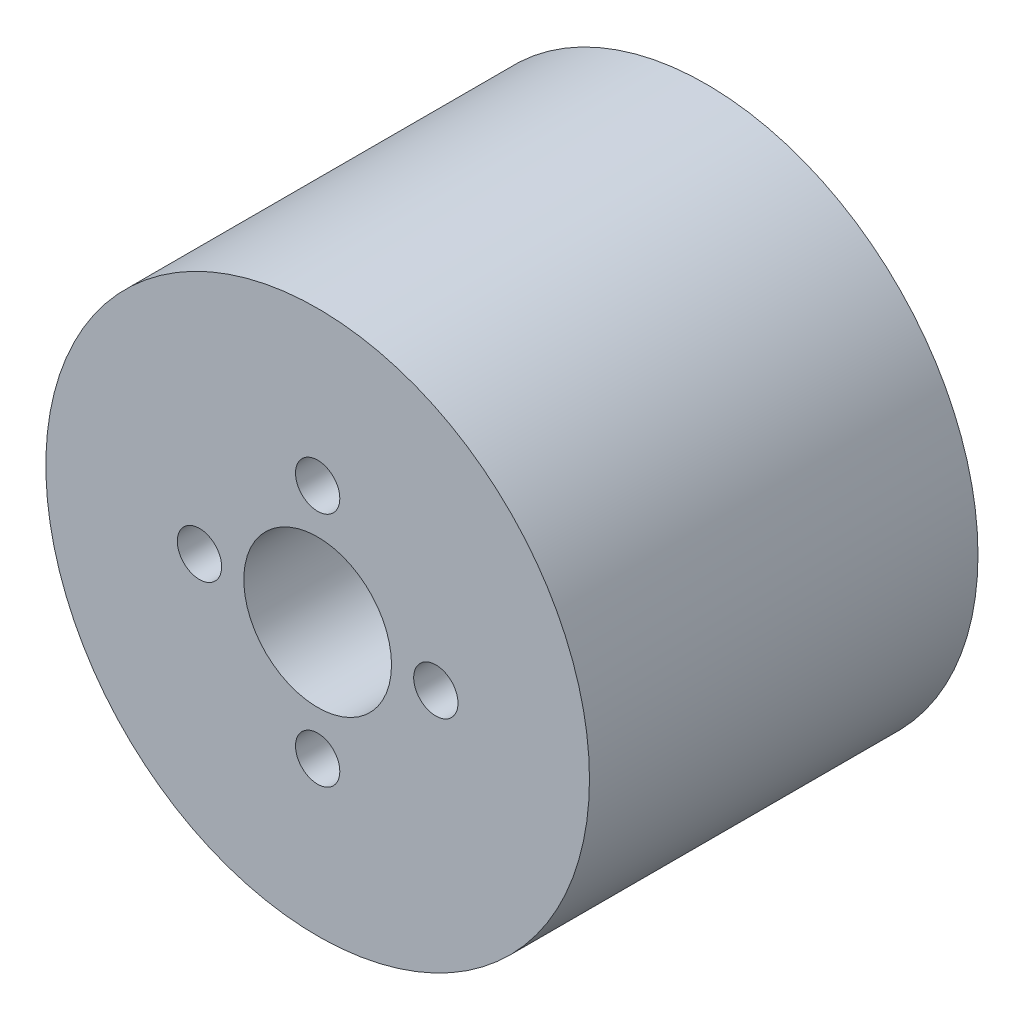
from build123d import *

# Parameters (mm, degrees)
CROQUIS1_R              = 18.4
SALIENTE_EXTRUIR1_DEPTH = 26.3
CROQUIS2_R              = 1.5
CORTAR_EXTRUIR1_DEPTH   = 3
CROQUIS3_R              = 5
CORTAR_EXTRUIR2_DEPTH   = 44
CORTAR_EXTRUIR3_START   = -3
CROQUIS4_R              = 1.5
CORTAR_EXTRUIR3_DEPTH   = 3


with BuildPart() as part:
    # Croquis1 → Saliente-Extruir1 (new body)
    with BuildSketch(Plane.XY):
        Circle(CROQUIS1_R)
    extrude(amount=SALIENTE_EXTRUIR1_DEPTH)

    # Croquis2 → Cortar-Extruir1 (cut)
    with BuildSketch(Plane.XY.offset(26.3)):
        with Locations((0, 8)):
            Circle(CROQUIS2_R)
        with Locations((8, 0)):
            Circle(CROQUIS2_R)
        with Locations((0, -8)):
            Circle(CROQUIS2_R)
        with Locations((-8, 0)):
            Circle(CROQUIS2_R)
    extrude(amount=-CORTAR_EXTRUIR1_DEPTH, mode=Mode.SUBTRACT)

    # Croquis3 → Cortar-Extruir2 (cut)
    with BuildSketch(Plane.XY.offset(26.3)):
        Circle(CROQUIS3_R)
    extrude(amount=-CORTAR_EXTRUIR2_DEPTH, mode=Mode.SUBTRACT)

    # Croquis4 → Cortar-Extruir3 (cut)
    with BuildSketch(Plane(origin=(0, 0, 0), x_dir=(-1, 0, 0), z_dir=(0, 0, -1)).offset(CORTAR_EXTRUIR3_START)):
        with Locations(Location((0, 8, 0), (0, 0, 180))):
            Circle(CROQUIS4_R)
        with Locations(Location((8, 0, 0), (0, 0, 180))):
            Circle(CROQUIS4_R)
        with Locations(Location((0, -8, 0), (0, 0, 180))):
            Circle(CROQUIS4_R)
        with Locations(Location((-8, 0, 0), (0, 0, 180))):
            Circle(CROQUIS4_R)
    extrude(amount=CORTAR_EXTRUIR3_DEPTH, mode=Mode.SUBTRACT)


solid = part.part
